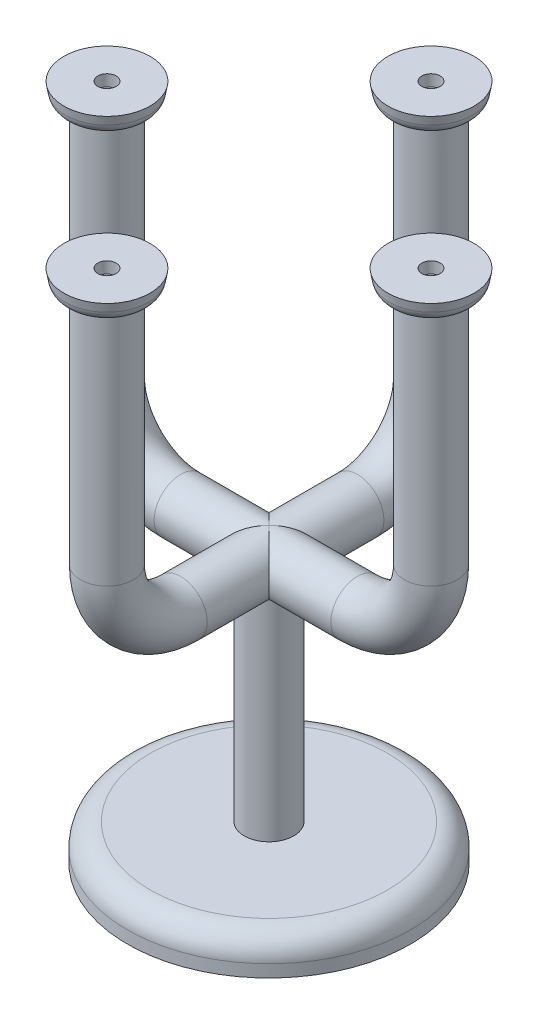
from build123d import *

# Parameters (mm, degrees)
SWEEP1_PROFILE_R  = 15
CIRPATTERN1_COUNT = 4
CIRPATTERN2_COUNT = 4


with BuildPart() as part:
    # Sketch1 → Revolve1 (revolve)
    with BuildSketch(Plane.XY, mode=Mode.PRIVATE) as revolve1_sk:
        with BuildLine():
            Line((0, 0), (0, 150))
            Line((0, 150), (14, 150))
            Line((14, 150), (14, 20))
            Line((14, 20), (67, 20))
            ThreePointArc((67, 20), (76.192388155, 16.192388155), (80, 7))
            Line((80, 7), (80, 0))
            Line((80, 0), (0, 0))
        make_face()
    revolve(revolve1_sk.sketch.rotate(Axis((0, 0, 0), (0, 1, 0)), 90), axis=Axis((0, 0, 0), (0, 1, 0)))

    # Sweep1: sweep along a path in Sketch2
    with BuildLine(Plane.XY) as sweep1_path:
        Line((0, 150), (49.928615656, 150))
        ThreePointArc((49.928615656, 150), (79.372138587, 162.195906522), (91.56804511, 191.639429454))
        Line((91.56804511, 191.639429454), (91.56804511, 325.397957769))
    # Sweep1 profile (on start of the path) → Sweep1 (sweep)
    with BuildSketch(Plane(origin=(0, 150, 0), x_dir=(0, 0, 1), z_dir=(1, 0, 0))):
        Circle(SWEEP1_PROFILE_R)
    sweep1 = sweep(path=sweep1_path.line)

    # CirPattern1: Sweep1 ×4 about axis
    cirpattern1_axis = Axis((0, 0, 0), (0, 1, 0))
    for i in range(1, CIRPATTERN1_COUNT):
        add(sweep1.rotate(cirpattern1_axis, i * 360 / CIRPATTERN1_COUNT))

    # Sketch18 → Revolve2 (revolve)
    with BuildSketch(Plane.XY.offset(91.56804511), mode=Mode.PRIVATE) as revolve2_sk:
        with BuildLine():
            Line((0, 325.397957769), (15.94299518, 325.397957769))
            ThreePointArc((15.94299518, 325.397957769), (20.842368901, 327.173817467), (23.465977558, 331.676507566))
            Line((23.465977558, 331.676507566), (24.359355308, 336.590289053))
            Line((24.359355308, 336.590289053), (5.172089719, 336.590289053))
            Line((5.172089719, 336.590289053), (5.172089719, 330.110653397))
            Line((5.172089719, 330.110653397), (0, 330.110653397))
            Line((0, 330.110653397), (0, 325.397957769))
        make_face()
    revolve2 = revolve(revolve2_sk.sketch.rotate(Axis((0, 330.110653397, 91.56804511), (0, -1, 0)), 180), axis=Axis((0, 330.110653397, 91.56804511), (0, -1, 0)))

    # CirPattern2: Revolve2 ×4 about axis
    cirpattern2_axis = Axis((0, 0, 0), (0, 1, 0))
    for i in range(1, CIRPATTERN2_COUNT):
        add(revolve2.rotate(cirpattern2_axis, i * 360 / CIRPATTERN2_COUNT))


solid = part.part
